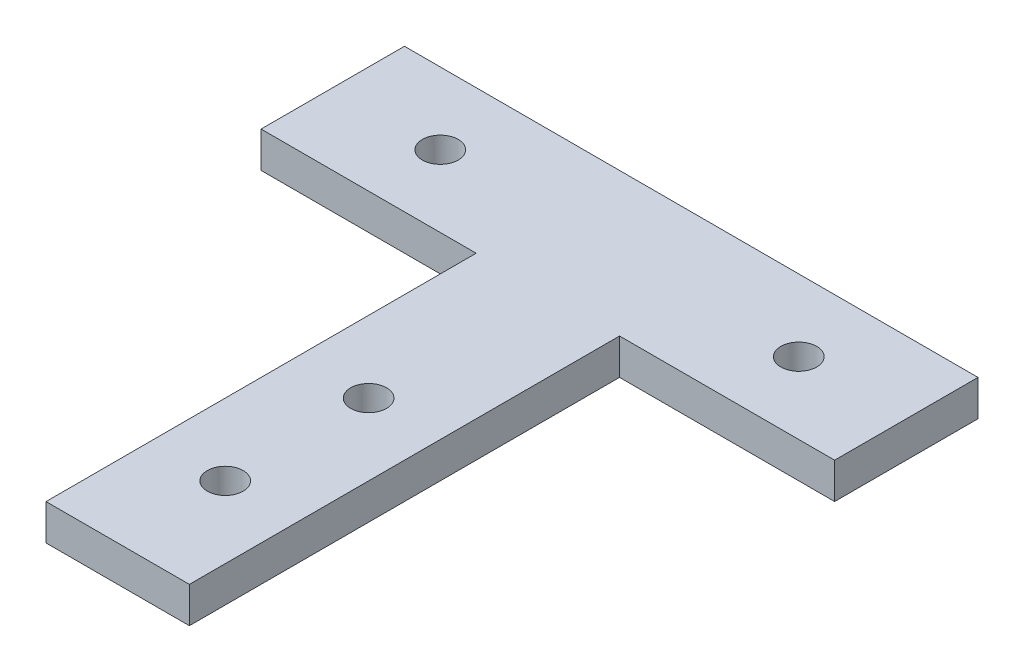
from build123d import *

# Parameters (mm, degrees)
SKETCH1_R           = 2.5
BOSS_EXTRUDE1_DEPTH = 5


with BuildPart() as part:
    # Sketch1 → Boss-Extrude1 (new body)
    with BuildSketch(Plane(origin=(0, 0, 0), x_dir=(1, 0, 0), z_dir=(0, 1, 0))):
        Polygon((-32.727272727, 5.858585859), (47.272727273, 5.858585859), (47.272727273, -14.141414141), (17.272727273, -14.141414141), (17.272727273, -74.141414141), (-2.727272727, -74.141414141), (-2.727272727, -14.141414141), (-32.727272727, -14.141414141), align=None)
        with Locations(Location((-17.727272727, -4.141414141, 0), (0, 0, 270))):
            Circle(SKETCH1_R, mode=Mode.SUBTRACT)
        with Locations(Location((7.272727273, -59.141414141, 0), (0, 0, 270))):
            Circle(SKETCH1_R, mode=Mode.SUBTRACT)
        with Locations(Location((7.272727273, -39.141414141, 0), (0, 0, 270))):
            Circle(SKETCH1_R, mode=Mode.SUBTRACT)
        with Locations(Location((32.272727273, -4.141414141, 0), (0, 0, 90))):
            Circle(SKETCH1_R, mode=Mode.SUBTRACT)
    extrude(amount=BOSS_EXTRUDE1_DEPTH)


solid = part.part
